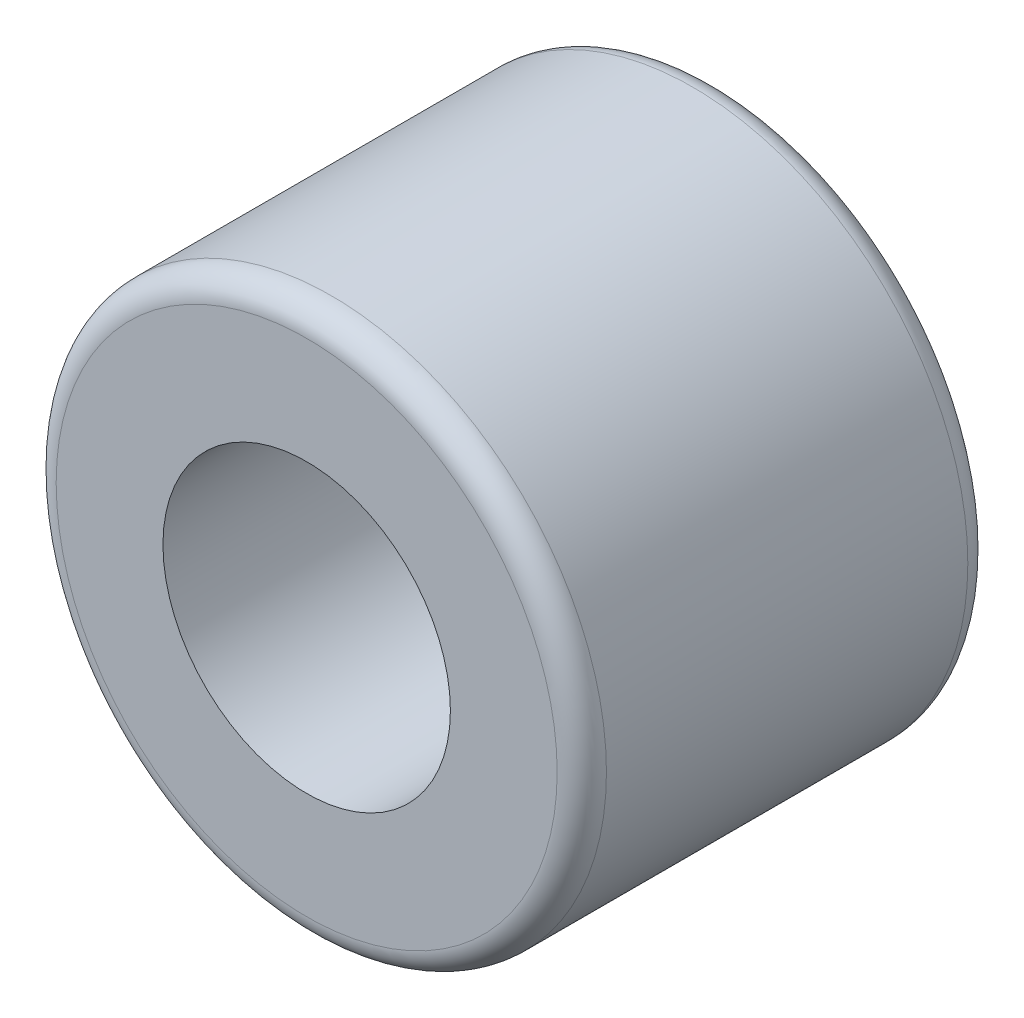
from build123d import *

# Parameters (mm, degrees)
SKETCH1_R           = 8.509
SKETCH1_R_2         = 4.445
BOSS_EXTRUDE1_DEPTH = 12.7
FILLET2_R           = 0.762


with BuildPart() as part:
    # Sketch1 → Boss-Extrude1 (new body)
    with BuildSketch(Plane.XY):
        Circle(SKETCH1_R)
        Circle(SKETCH1_R_2, mode=Mode.SUBTRACT)
    extrude(amount=BOSS_EXTRUDE1_DEPTH)

    # Fillet2
    fillet2_edges = [part.edges().sort_by_distance(p)[0] for p in [
        (-8.509, 0, 0),
        (-8.509, 0, 12.7),
    ]]
    fillet(fillet2_edges, radius=FILLET2_R)


solid = part.part
